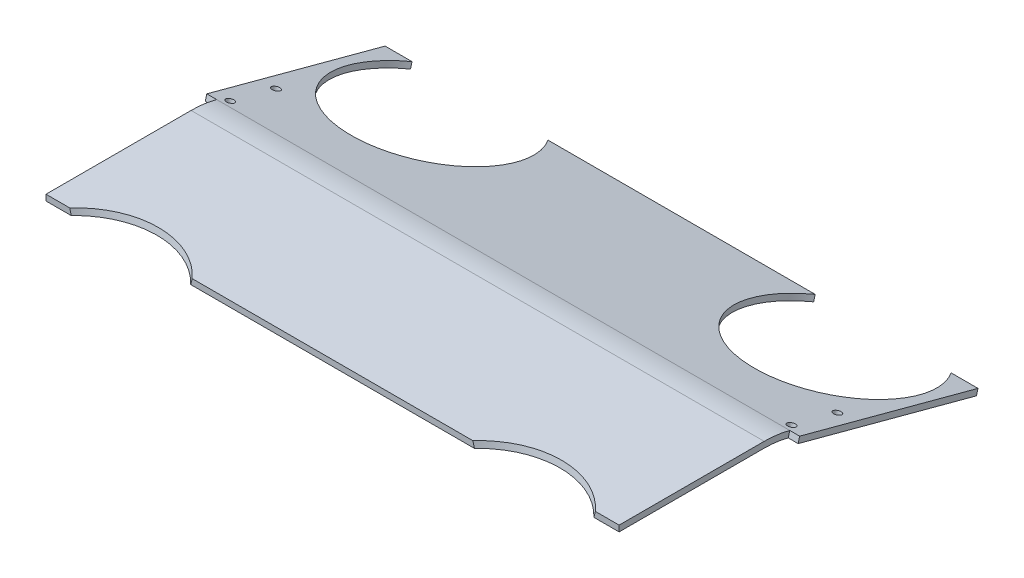
from build123d import *

# Parameters (mm, degrees)
BOSS_EXTRUDE1_DEPTH = 300
SKETCH2_R           = 42.5
SKETCH2_W           = 5
SKETCH2_H           = 83.856690982
CUT_EXTRUDE1_DEPTH  = 349.855848061
SKETCH3_R           = 2
CUT_EXTRUDE2_DEPTH  = 349.855848061


with BuildPart() as part:
    # Sketch1 → Boss-Extrude1 (new body)
    with BuildSketch(Plane(origin=(0, 0, 0), x_dir=(0, 0, -1), z_dir=(1, 0, 0))):
        with BuildLine():
            Line((0, 0), (73.417375121, 0))
            ThreePointArc((73.417375121, 0), (79.943684732, -0.427756931), (86.358327376, -1.703708686))
            Line((86.358327376, -1.703708686), (176.592582629, -25.88190451))
            Line((176.592582629, -25.88190451), (175.816125494, -28.779681989))
            Line((175.816125494, -28.779681989), (85.58187024, -4.601486164))
            ThreePointArc((85.58187024, -4.601486164), (79.552106155, -3.402091515), (73.417375121, -3))
            Line((73.417375121, -3), (0, -3))
            Line((0, -3), (0, 0))
        make_face()
    extrude(amount=BOSS_EXTRUDE1_DEPTH)

    # Sketch2 → Cut-Extrude1 (cut, through all)
    with BuildSketch(Plane(origin=(0, 20, -5.358983849), x_dir=(1, 0, 0), z_dir=(0, 0.9659258262890681, -0.25881904510252174))):
        with Locations((48, 152.274066103)):
            Circle(SKETCH2_R)
        with Locations((252, 152.274066103)):
            Circle(SKETCH2_R)
        with Locations((48, -29.084261273)):
            Circle(SKETCH2_R)
        with Locations((252, -29.084261273)):
            Circle(SKETCH2_R)
        with Locations((2.5, 41.928345491)):
            Rectangle(SKETCH2_W, SKETCH2_H)
        with Locations((297.5, 41.928345491)):
            Rectangle(SKETCH2_W, SKETCH2_H)
    extrude(amount=-CUT_EXTRUDE1_DEPTH, mode=Mode.SUBTRACT)

    # Sketch3 → Cut-Extrude2 (cut, through all)
    with BuildSketch(Plane(origin=(0, 20, -5.358983849), x_dir=(1, 0, 0), z_dir=(0, 0.9659258262890681, -0.25881904510252174))):
        with Locations(Location((8, 87.856690982, 0), (0, 0, 270))):
            Circle(SKETCH3_R)
        with Locations(Location((8, 111.856690982, 0), (0, 0, 270))):
            Circle(SKETCH3_R)
        with Locations(Location((292, 87.856690982, 0), (0, 0, 270))):
            Circle(SKETCH3_R)
        with Locations(Location((292, 111.856690982, 0), (0, 0, 270))):
            Circle(SKETCH3_R)
    extrude(amount=-CUT_EXTRUDE2_DEPTH, mode=Mode.SUBTRACT)


solid = part.part
